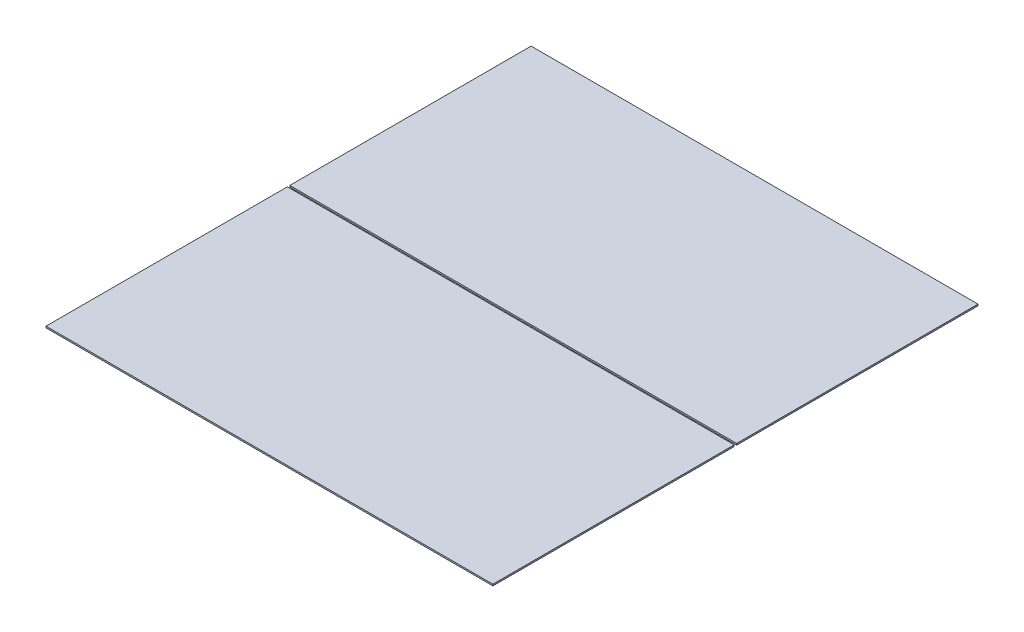
from build123d import *

# Parameters (mm, degrees)
BOSS_EXTRUDE1_DEPTH             = 2.5
BOSS_EXTRUDE1_DEPTH_BACK        = 2.5
SKETCH1_W                       = 1473.2
SKETCH1_H                       = 790.1
BOSS_EXTRUDE1_2_DEPTH           = 2.5
BOSS_EXTRUDE1_2_DEPTH_BACK      = 2.5
BOSS_EXTRUDE2_REACH             = 1089.541
SKETCH2_W                       = 1485.2
SKETCH2_H                       = 802.1
SKETCH2_W_2                     = 1473.2
SKETCH2_H_2                     = 790.1
BOSS_EXTRUDE2_DIRECTION_2_REACH = 1089.541


with BuildPart() as part:
    # Sketch1 → Boss-Extrude1 (new, two sides: drawn at the far end of the back side and taken through both)
    with BuildSketch(Plane(origin=(0, 0, 0), x_dir=(1, 0, 0), z_dir=(0, 1, 0)).offset(-BOSS_EXTRUDE1_DEPTH_BACK)):
        with Locations((0, 405.05)):
            Rectangle(SKETCH1_W, SKETCH1_H)
    extrude(amount=BOSS_EXTRUDE1_DEPTH + BOSS_EXTRUDE1_DEPTH_BACK)

    # Boss-Extrude2: up to this face of the body (flat: up to its plane)
    boss_extrude2_end = Plane(part.part.faces().sort_by_distance((0, 2.5, -405.05))[0])
    # Sketch2 → Boss-Extrude2 (add, up to the picked face)
    with BuildSketch(Plane(origin=(0, 0, 0), x_dir=(1, 0, 0), z_dir=(0, 1, 0)), mode=Mode.PRIVATE) as boss_extrude2_sk1:
        with Locations((0, 405.05)):
            Rectangle(SKETCH2_W, SKETCH2_H)
        with Locations((0, 405.05)):
            Rectangle(SKETCH2_W_2, SKETCH2_H_2, mode=Mode.SUBTRACT)
    boss_extrude2_tool1 = split(extrude(boss_extrude2_sk1.sketch, amount=BOSS_EXTRUDE2_REACH, mode=Mode.PRIVATE), bisect_by=boss_extrude2_end, keep=Keep.BOTH, mode=Mode.PRIVATE)
    # Sketch2 → Boss-Extrude2 (add, up to the picked face)
    with BuildSketch(Plane(origin=(0, 0, 0), x_dir=(1, 0, 0), z_dir=(0, 1, 0)), mode=Mode.PRIVATE) as boss_extrude2_sk2:
        with Locations((0, -405.05)):
            Rectangle(SKETCH2_W, SKETCH2_H)
        with Locations((0, -405.05)):
            Rectangle(SKETCH2_W_2, SKETCH2_H_2, mode=Mode.SUBTRACT)
    boss_extrude2_tool2 = split(extrude(boss_extrude2_sk2.sketch, amount=BOSS_EXTRUDE2_REACH, mode=Mode.PRIVATE), bisect_by=boss_extrude2_end, keep=Keep.BOTH, mode=Mode.PRIVATE)


with BuildPart() as body_2:
    # Sketch1 → Boss-Extrude1 2 (new, two sides: drawn at the far end of the back side and taken through both)
    with BuildSketch(Plane(origin=(0, 0, 0), x_dir=(1, 0, 0), z_dir=(0, 1, 0)).offset(-BOSS_EXTRUDE1_2_DEPTH_BACK)):
        with Locations((0, -405.05)):
            Rectangle(SKETCH1_W, SKETCH1_H)
    extrude(amount=BOSS_EXTRUDE1_2_DEPTH + BOSS_EXTRUDE1_2_DEPTH_BACK)


with BuildPart() as part_1:
    add(part.part)

    add(body_2.part)  # Boss-Extrude2 merges body 2
    add(boss_extrude2_tool1.solids().sort_by(Axis((0, 0, -804.412048), (0, 1, 0)))[0])
    add(boss_extrude2_tool2.solids().sort_by(Axis((0, 0, 804.412048), (0, 1, 0)))[0])

    # Boss-Extrude2 direction 2: up to this face of the body (flat: up to its plane)
    boss_extrude2_direction_2_end = Plane(part_1.part.faces().sort_by_distance((0, -2.5, -405.05))[0])
    # Sketch2 → Boss-Extrude2 direction 2 (add, up to the picked face)
    with BuildSketch(Plane(origin=(0, 0, 0), x_dir=(1, 0, 0), z_dir=(0, 1, 0)), mode=Mode.PRIVATE) as boss_extrude2_direction_2_sk1:
        with Locations((0, 405.05)):
            Rectangle(SKETCH2_W, SKETCH2_H)
        with Locations((0, 405.05)):
            Rectangle(SKETCH2_W_2, SKETCH2_H_2, mode=Mode.SUBTRACT)
    boss_extrude2_direction_2_tool1 = split(extrude(boss_extrude2_direction_2_sk1.sketch, amount=-BOSS_EXTRUDE2_DIRECTION_2_REACH, mode=Mode.PRIVATE), bisect_by=boss_extrude2_direction_2_end, keep=Keep.BOTH, mode=Mode.PRIVATE)
    # Sketch2 → Boss-Extrude2 direction 2 (add, up to the picked face)
    with BuildSketch(Plane(origin=(0, 0, 0), x_dir=(1, 0, 0), z_dir=(0, 1, 0)), mode=Mode.PRIVATE) as boss_extrude2_direction_2_sk2:
        with Locations((0, -405.05)):
            Rectangle(SKETCH2_W, SKETCH2_H)
        with Locations((0, -405.05)):
            Rectangle(SKETCH2_W_2, SKETCH2_H_2, mode=Mode.SUBTRACT)
    boss_extrude2_direction_2_tool2 = split(extrude(boss_extrude2_direction_2_sk2.sketch, amount=-BOSS_EXTRUDE2_DIRECTION_2_REACH, mode=Mode.PRIVATE), bisect_by=boss_extrude2_direction_2_end, keep=Keep.BOTH, mode=Mode.PRIVATE)
    add(boss_extrude2_direction_2_tool1.solids().sort_by(Axis((0, 0, -804.412048), (0, -1, 0)))[0])
    add(boss_extrude2_direction_2_tool2.solids().sort_by(Axis((0, 0, 804.412048), (0, -1, 0)))[0])


solid = part_1.part
